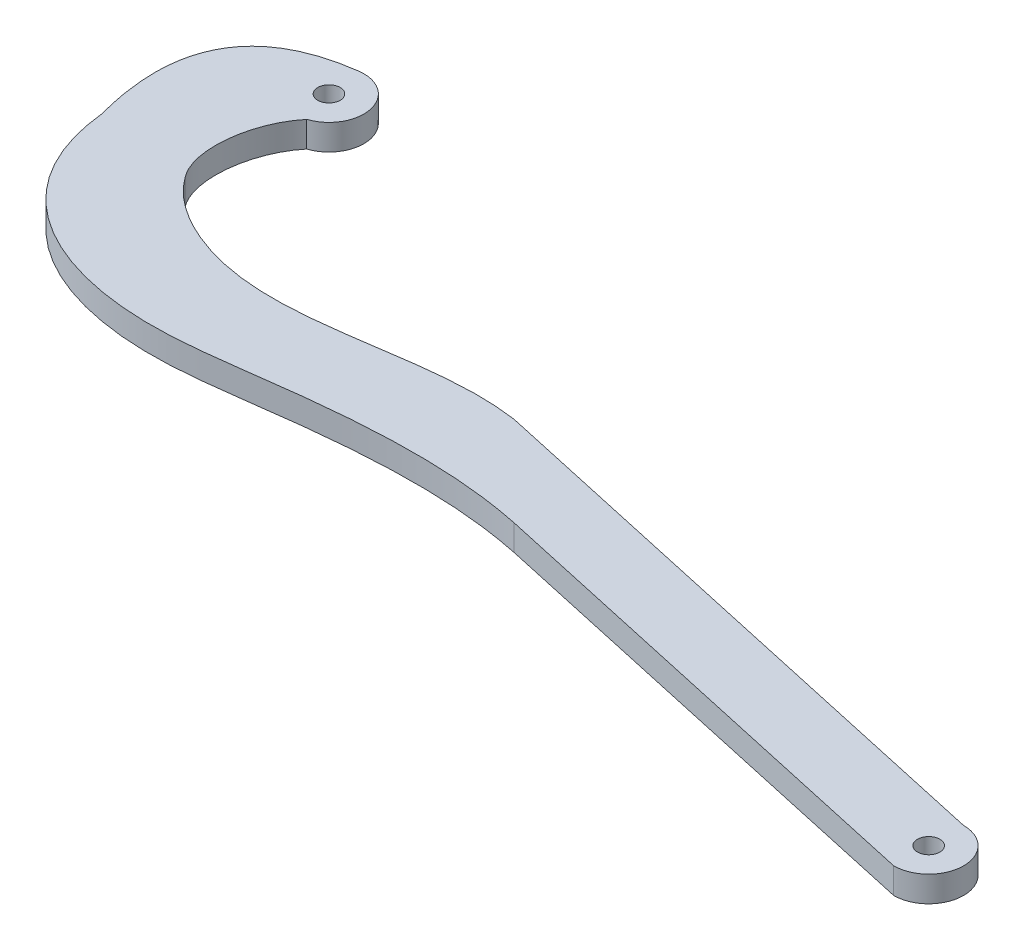
from build123d import *

# Parameters (mm, degrees)
BOSS_EXTRUDE1_DEPTH = 5.842


with BuildPart() as part:
    # Sketch1 → Boss-Extrude1 (new body)
    # profile 1 of 4: a face of its own
    with BuildSketch(Plane(origin=(0, 0, 0), x_dir=(1, 0, 0), z_dir=(0, 1, 0))):
        with BuildLine():
            Line((5.702829673, -2.106146828), (2.382698971, -0.879969097))
            ThreePointArc((2.382698971, -0.879969097), (-0.446958954, -2.500365512), (-2.54, 0))
            ThreePointArc((-2.54, 0), (0, 2.54), (2.54, 0))
            Line((2.54, 0), (7.9375, 0))
            ThreePointArc((7.9375, 0), (5.261697448, 5.942932459), (-0.961636054, 7.879033085))
            add(Edge.make_bspline(
                [(-0.961636054, 7.879033085), (-30.998516546, 4.016509883), (-21.878356409, -29.675127641)],
                knots=[0, 0, 0, 0.355275027, 0.355275027, 0.355275027], degree=2))
            add(Edge.make_bspline(
                [(-21.878356409, -29.675127641), (-19.175708983, -55.861204147), (11.698983968, -69.097417628), (59.195053048, -61.613083253), (86.70608699, -59.429980277), (105.423206443, -63.354848985)],
                knots=[0, 0, 0, 0, 0.428303153, 0.609288088, 1, 1, 1, 1], degree=3))
            Line((105.423206443, -63.354848985), (212.680451258, -86.98087497))
            Line((212.680451258, -86.98087497), (216.015488734, -87.715498371))
            ThreePointArc((216.015488734, -87.715498371), (223.952988734, -79.777998371), (216.015488734, -71.840498371))
            Line((216.015488734, -71.840498371), (84.985142991, -42.97786668))
            add(Edge.make_bspline(
                [(0.09474692, -32.76830731), (4.27176872, -38.654864898), (33.548769413, -54.534810158), (63.191046617, -39.772775003), (84.985142991, -42.97786668)],
                knots=[0.196438425, 0.196438425, 0.196438425, 0.196438425, 0.402512938, 1, 1, 1, 1], degree=3))
            add(Edge.make_bspline(
                [(-1.126256356, -30.819140758), (-0.777763255, -31.521796137), (-0.371419038, -32.175243295), (0.09474692, -32.76830731)],
                knots=[0.355072169, 0.355072169, 0.355072169, 0.355072169, 0.385912125, 0.385912125, 0.385912125, 0.385912125], degree=3))
            add(Edge.make_bspline(
                [(2.490643555, -7.53661734), (-2.624036668, -13.613014345), (-4.349309359, -24.320603116), (-1.126256356, -30.819140758)],
                knots=[0.069847551, 0.069847551, 0.069847551, 0.069847551, 0.355072169, 0.355072169, 0.355072169, 0.355072169], degree=3))
            ThreePointArc((2.490643555, -7.53661734), (5.51471235, -5.708927565), (7.445934285, -2.749903429))
            Line((7.445934285, -2.749903429), (5.702829673, -2.106146828))
        make_face()
        with BuildLine():
            ThreePointArc((213.632789762, -78.898029274), (216.462447688, -77.27763286), (218.555488734, -79.777998371))
            ThreePointArc((218.555488734, -79.777998371), (215.56852978, -82.278363883), (213.632789762, -78.898029274))
        make_face(mode=Mode.SUBTRACT)
    # profile 2 of 4: a face of its own
    with BuildSketch(Plane(origin=(0, 0, 0), x_dir=(1, 0, 0), z_dir=(0, 1, 0))):
        with BuildLine():
            add(Edge.make_bspline(
                [(5.702829673, -2.106146828), (6.77439514, -1.073513348), (7.9375, 0)],
                knots=[0.965211712, 0.965211712, 0.965211712, 1, 1, 1], degree=2))
            Line((5.702829673, -2.106146828), (7.445934285, -2.749903429))
            ThreePointArc((7.445934285, -2.749903429), (7.813642225, -1.396746731), (7.9375, 0))
        make_face()
    # profile 3 of 4: a face of its own
    with BuildSketch(Plane(origin=(0, 0, 0), x_dir=(1, 0, 0), z_dir=(0, 1, 0))):
        with BuildLine():
            ThreePointArc((2.54, 0), (2.500365512, -0.446958954), (2.382698971, -0.879969097))
            Line((2.382698971, -0.879969097), (5.702829673, -2.106146828))
            add(Edge.make_bspline(
                [(5.702829673, -2.106146828), (6.77439514, -1.073513348), (7.9375, 0)],
                knots=[0.965211712, 0.965211712, 0.965211712, 1, 1, 1], degree=2))
            Line((7.9375, 0), (2.54, 0))
        make_face()
    # profile 4 of 4: a face of its own
    with BuildSketch(Plane(origin=(0, 0, 0), x_dir=(1, 0, 0), z_dir=(0, 1, 0))):
        with BuildLine():
            add(Edge.make_bspline(
                [(5.702829673, -2.106146828), (6.77439514, -1.073513348), (7.9375, 0)],
                knots=[0.965211712, 0.965211712, 0.965211712, 1, 1, 1], degree=2))
            Line((5.702829673, -2.106146828), (7.445934285, -2.749903429))
            ThreePointArc((7.445934285, -2.749903429), (7.813642225, -1.396746731), (7.9375, 0))
        make_face()
    extrude(amount=BOSS_EXTRUDE1_DEPTH)


solid = part.part
